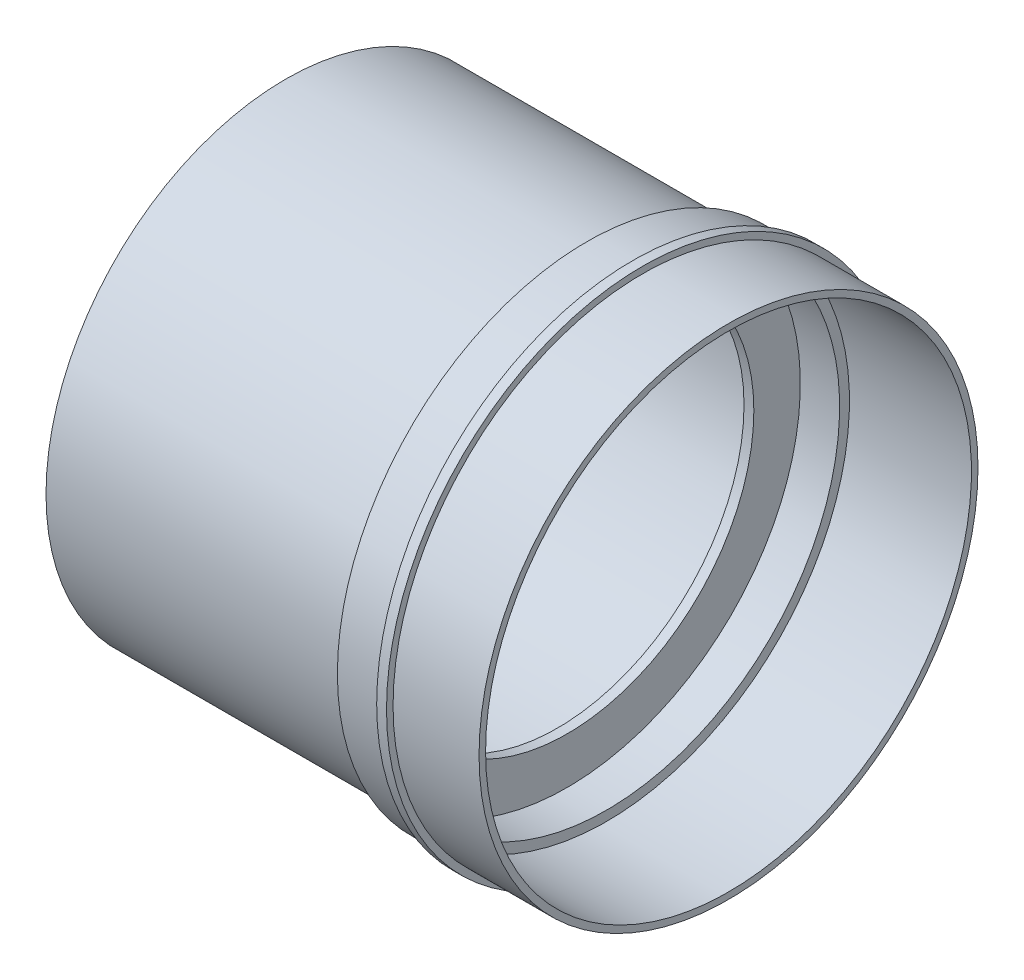
from build123d import *


with BuildPart() as part:
    # Sketch1 → Revolve1 (revolve)
    with BuildSketch(Plane.XY, mode=Mode.PRIVATE) as revolve1_sk:
        Polygon((3, 71.2), (15, 71.2), (15, 74.2), (52.263541851, 74.2), (52.263541851, 76.2), (26, 76.2), (26, 78.2), (23, 78.2), (23, 76.2), (9, 76.2), (9, 73.2), (-83, 73.2), (-83, 71.2), (0, 71.2), (0, 57), (3, 57), align=None)
    revolve(revolve1_sk.sketch.rotate(Axis((-34.473771286, 0, 0), (1, 0, 0)), 90), axis=Axis((-34.473771286, 0, 0), (1, 0, 0)))


solid = part.part
